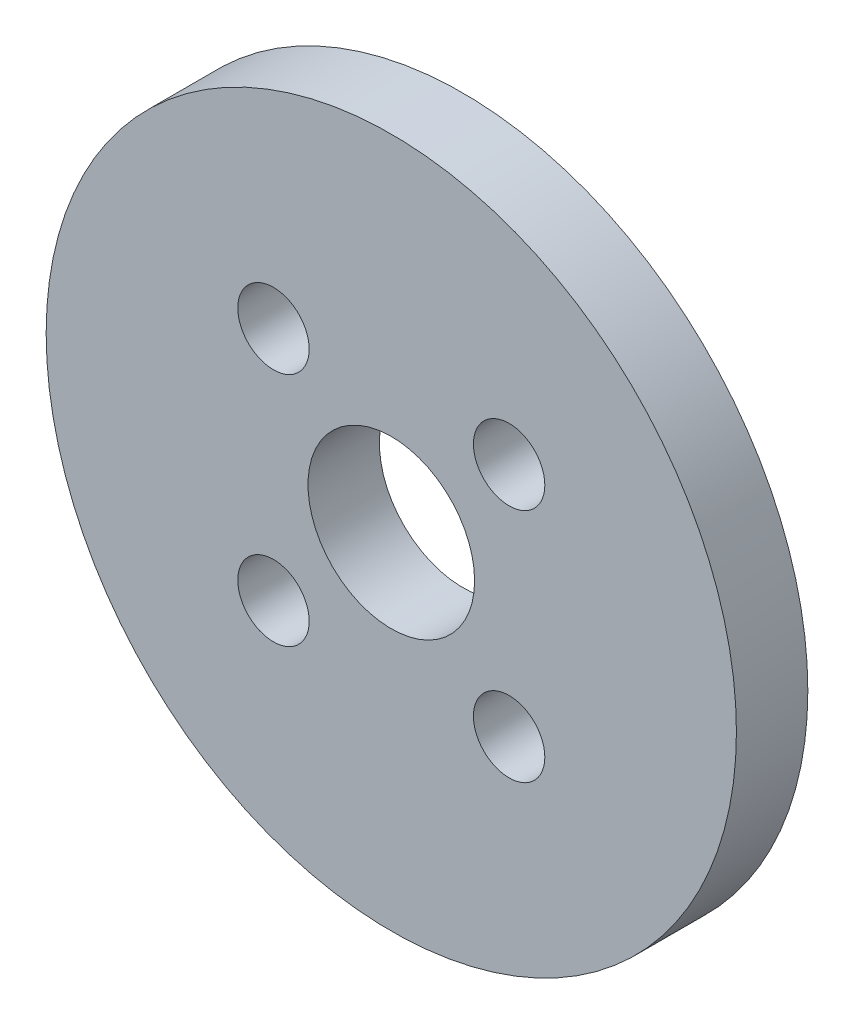
from build123d import *

# Parameters (mm, degrees)
SKETCH1_R           = 14.5
SKETCH1_R_2         = 3.5
SKETCH1_R_3         = 1.5
BOSS_EXTRUDE1_DEPTH = 3


with BuildPart() as part:
    # Sketch1 → Boss-Extrude1 (new body)
    with BuildSketch(Plane.XY):
        Circle(SKETCH1_R)
        Circle(SKETCH1_R_2, mode=Mode.SUBTRACT)
        with Locations((-4.949747468, 4.949747468)):
            Circle(SKETCH1_R_3, mode=Mode.SUBTRACT)
        with Locations((4.949747468, 4.949747468)):
            Circle(SKETCH1_R_3, mode=Mode.SUBTRACT)
        with Locations((4.949747468, -4.949747468)):
            Circle(SKETCH1_R_3, mode=Mode.SUBTRACT)
        with Locations((-4.949747468, -4.949747468)):
            Circle(SKETCH1_R_3, mode=Mode.SUBTRACT)
    extrude(amount=BOSS_EXTRUDE1_DEPTH)


solid = part.part
